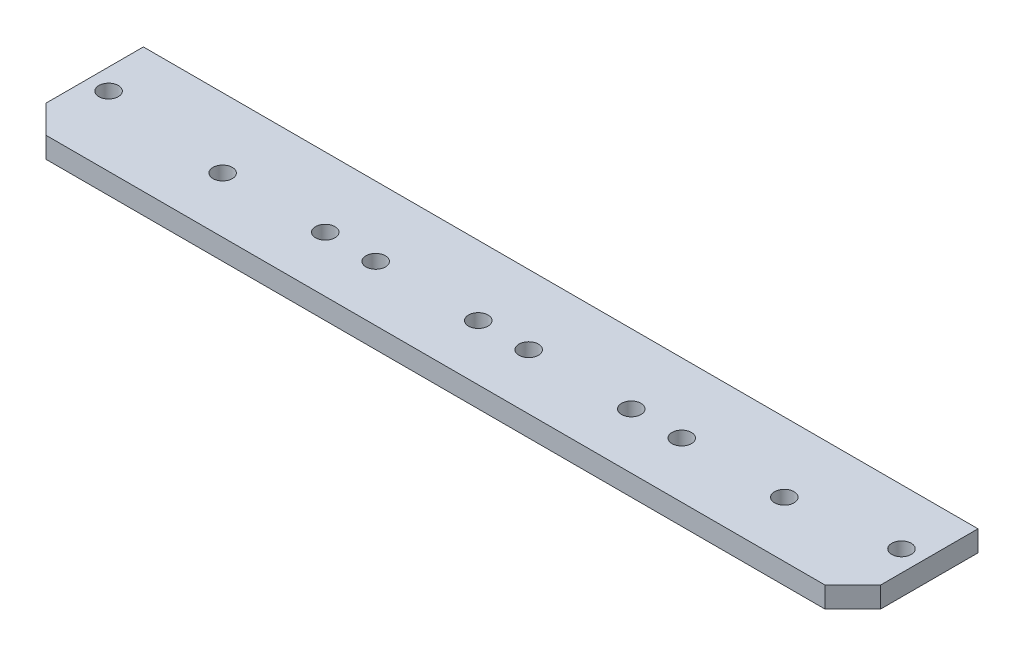
from build123d import *

# Parameters (mm, degrees)
SKETCH_1_W          = 120
SKETCH_1_H          = 35
EXTRUDE_1_DEPTH     = 3
SKETCH_2_W          = 30
SKETCH_2_H          = 17
CUT_EXTRUDE_1_DEPTH = 63.571958576
SKETCH_3_R          = 1.4
CUT_EXTRUDE_2_DEPTH = 63.571958576
SKETCH_4_R          = 1.4
CUT_EXTRUDE_3_DEPTH = 63.571958576
SKETCH_5_W          = 10
SKETCH_5_H          = 5
CUT_EXTRUDE_4_DEPTH = 63.571958576
CHAMFER_1_SIZE      = 4
CHAMFER_1_SIZE2     = 8.578027682
CHAMFER_2_SIZE      = 4
CHAMFER_2_SIZE2     = 8.578027682
FILLET_1_R          = 5
CHAMFER_3_SIZE      = 4
SKETCH_6_W          = 120
SKETCH_6_H          = 17
CUT_EXTRUDE_5_DEPTH = 63.571958576


with BuildPart() as part:
    # 草图1 → 凸台-拉伸1 (new body)
    with BuildSketch(Plane(origin=(0, 0, 0), x_dir=(1, 0, 0), z_dir=(0, 1, 0))):
        Rectangle(SKETCH_1_W, SKETCH_1_H)
    extrude(amount=EXTRUDE_1_DEPTH)

    # 草图2 → 切除-拉伸1 (cut, through all)
    with BuildSketch(Plane(origin=(0, 3, 0), x_dir=(1, 0, 0), z_dir=(0, 1, 0))):
        with Locations((0, 9)):
            Rectangle(SKETCH_2_W, SKETCH_2_H)
    extrude(amount=-CUT_EXTRUDE_1_DEPTH, mode=Mode.SUBTRACT)

    # 草图3 → 切除-拉伸2 (cut, through all)
    with BuildSketch(Plane(origin=(0, 3, 0), x_dir=(1, 0, 0), z_dir=(0, 1, 0))):
        with Locations(Location((-57, 12.5, 0), (0, 0, 270))):
            Circle(SKETCH_3_R)
        with Locations(Location((-57, -7.5, 0), (0, 0, 270))):
            Circle(SKETCH_3_R)
        with Locations(Location((57, -7.5, 0), (0, 0, 90))):
            Circle(SKETCH_3_R)
        with Locations(Location((57, 12.5, 0), (0, 0, 90))):
            Circle(SKETCH_3_R)
    extrude(amount=-CUT_EXTRUDE_2_DEPTH, mode=Mode.SUBTRACT)

    # 草图4 → 切除-拉伸3 (cut, through all)
    with BuildSketch(Plane(origin=(0, 3, 0), x_dir=(1, 0, 0), z_dir=(0, 1, 0))):
        with Locations(Location((5.4, -9.5, 0), (0, 0, 270))):
            Circle(SKETCH_4_R)
        with Locations(Location((20.15, -9.5, 0), (0, 0, 270))):
            Circle(SKETCH_4_R)
        with Locations(Location((27.4, -9.5, 0), (0, 0, 270))):
            Circle(SKETCH_4_R)
        with Locations(Location((42.15, -9.5, 0), (0, 0, 270))):
            Circle(SKETCH_4_R)
        with Locations(Location((-1.85, -9.5, 0), (0, 0, 270))):
            Circle(SKETCH_4_R)
        with Locations(Location((-16.6, -9.5, 0), (0, 0, 270))):
            Circle(SKETCH_4_R)
        with Locations(Location((-23.85, -9.5, 0), (0, 0, 270))):
            Circle(SKETCH_4_R)
        with Locations(Location((-38.6, -9.5, 0), (0, 0, 270))):
            Circle(SKETCH_4_R)
    extrude(amount=-CUT_EXTRUDE_3_DEPTH, mode=Mode.SUBTRACT)

    # 草图5 → 切除-拉伸4 (cut, through all)
    with BuildSketch(Plane(origin=(0, 3, 0), x_dir=(1, 0, 0), z_dir=(0, 1, 0))):
        with Locations((-30, 7.5)):
            Rectangle(SKETCH_5_W, SKETCH_5_H)
        with Locations((30, 7.5)):
            Rectangle(SKETCH_5_W, SKETCH_5_H)
    extrude(amount=-CUT_EXTRUDE_4_DEPTH, mode=Mode.SUBTRACT)

    # 倒角1
    chamfer_1_edges = [part.edges().sort_by_distance(p)[0] for p in [
        (-15, 1.5, -17.5),
    ]]
    chamfer_1_side = [part.faces().sort_by_distance(p)[0] for p in [
        (-37.5, 1.5, -17.5),
    ]]
    chamfer(chamfer_1_edges, length=CHAMFER_1_SIZE, length2=CHAMFER_1_SIZE2, reference=chamfer_1_side[0])

    # 倒角2
    chamfer_2_edges = [part.edges().sort_by_distance(p)[0] for p in [
        (15, 1.5, -17.5),
    ]]
    chamfer_2_side = [part.faces().sort_by_distance(p)[0] for p in [
        (37.5, 1.5, -17.5),
    ]]
    chamfer(chamfer_2_edges, length=CHAMFER_2_SIZE, length2=CHAMFER_2_SIZE2, reference=chamfer_2_side[0])

    # 圆角1
    fillet_1_edges = [part.edges().sort_by_distance(p)[0] for p in [
        (-15, 1.5, -0.5),
        (15, 1.5, -0.5),
    ]]
    fillet(fillet_1_edges, radius=FILLET_1_R)

    # 倒角3
    chamfer_3_edges = [part.edges().sort_by_distance(p)[0] for p in [
        (60, 1.5, 17.5),
        (-60, 1.5, 17.5),
    ]]
    chamfer(chamfer_3_edges, length=CHAMFER_3_SIZE)

    # 草图6 → 切除-拉伸5 (cut, through all)
    with BuildSketch(Plane(origin=(0, 3, 0), x_dir=(1, 0, 0), z_dir=(0, 1, 0))):
        with Locations((0, 9)):
            Rectangle(SKETCH_6_W, SKETCH_6_H)
    extrude(amount=-CUT_EXTRUDE_5_DEPTH, mode=Mode.SUBTRACT)


solid = part.part
